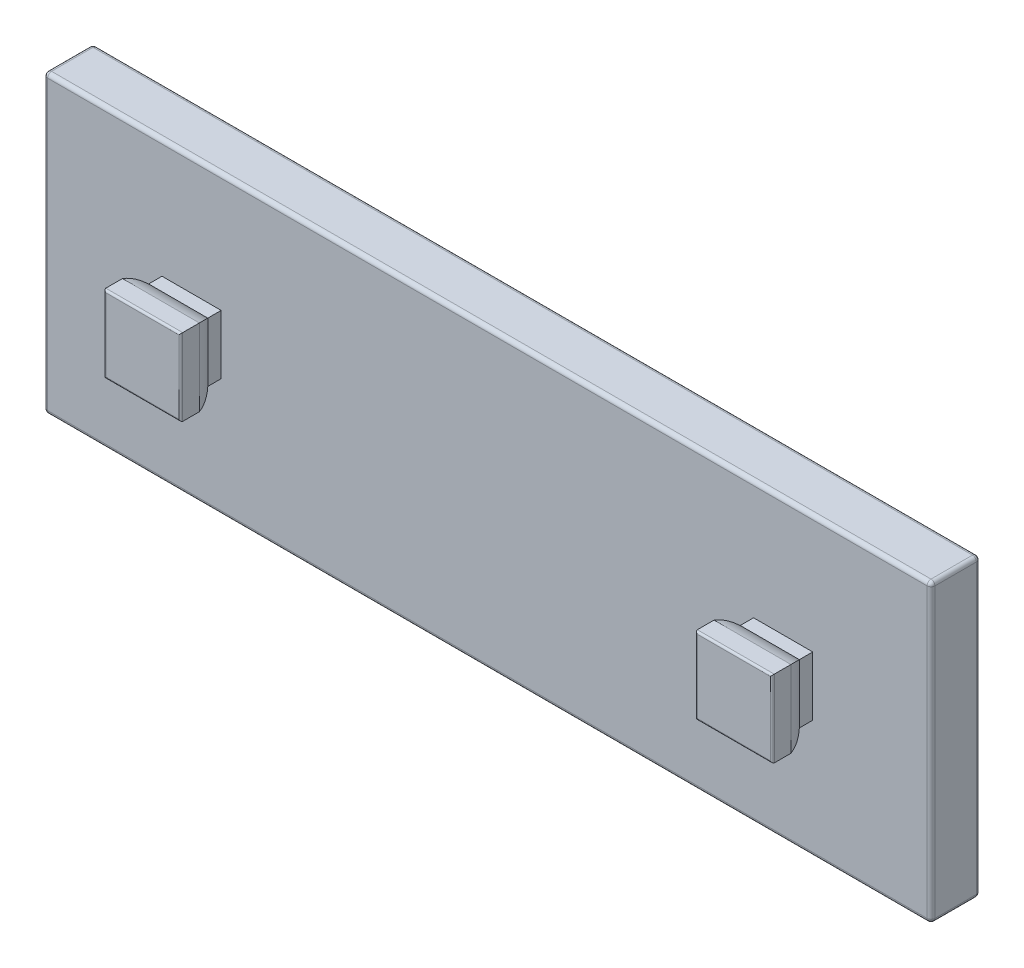
from build123d import *

# Parameters (mm, degrees)
SKETCH_1_W           = 45
SKETCH_1_H           = 15
EXTRUDE_1_DEPTH      = 2.5
SKETCH_2_W           = 3
SKETCH_2_H           = 3
EXTRUDE_2_DEPTH      = 1
EXTRUDE_3_DEPTH      = 2
EXTRUDE_3_DEPTH_BACK = 2
CUT_EXTRUDE_1_DEPTH  = 41.234344782
FILLET_1_R           = 0.2
FILLET_2_R           = 0.1
EXTRUDE_4_DEPTH      = 2
CUT_EXTRUDE_2_DEPTH  = 10
FILLET_3_R           = 0.1


with BuildPart() as part:
    # 草图1 → 凸台-拉伸1 (new body)
    with BuildSketch(Plane.XY):
        Rectangle(SKETCH_1_W, SKETCH_1_H)
    extrude(amount=-EXTRUDE_1_DEPTH)

    # 草图2 → 凸台-拉伸2 (add)
    with BuildSketch(Plane.XY):
        with Locations((-15, 0)):
            Rectangle(SKETCH_2_W, SKETCH_2_H)
        with Locations((15, 0)):
            Rectangle(SKETCH_2_W, SKETCH_2_H)
    extrude(amount=EXTRUDE_2_DEPTH)

    # 草图3 → 凸台-拉伸3 (add, two sides: drawn at the far end of the back side and taken through both)
    with BuildSketch(Plane(origin=(0, 0, 0), x_dir=(1, 0, 0), z_dir=(0, 1, 0)).offset(-EXTRUDE_3_DEPTH_BACK)):
        with BuildLine():
            Line((-16.95, -2.5), (-13.05, -2.5))
            Line((-13.05, -2.5), (-13.05, -1.555590279))
            ThreePointArc((-13.05, -1.555590279), (-13.219957697, -1.088161527), (-13.5, -0.677124344))
            Line((-13.5, -0.677124344), (-16.5, -0.677124344))
            ThreePointArc((-16.5, -0.677124344), (-16.780042303, -1.088161527), (-16.95, -1.555590279))
            Line((-16.95, -1.555590279), (-16.95, -2.5))
        make_face()
        with BuildLine():
            Line((16.5, -0.677124344), (13.5, -0.677124344))
            ThreePointArc((13.5, -0.677124344), (13.219957697, -1.088161527), (13.05, -1.555590279))
            Line((13.05, -1.555590279), (13.05, -2.5))
            Line((13.05, -2.5), (16.95, -2.5))
            Line((16.95, -2.5), (16.95, -1.555590279))
            ThreePointArc((16.95, -1.555590279), (16.780042303, -1.088161527), (16.5, -0.677124344))
        make_face()
    extrude(amount=EXTRUDE_3_DEPTH + EXTRUDE_3_DEPTH_BACK)

    # 草图4 → 切除-拉伸1 (cut, through all)
    with BuildSketch(Plane.ZY.offset(16.95)):
        with BuildLine():
            Line((2.5, 1.95), (1.555590279, 1.95))
            ThreePointArc((1.555590279, 1.95), (1.088161527, 1.780042303), (0.677124344, 1.5))
            Line((0.677124344, 1.5), (0.677124344, 2))
            Line((0.677124344, 2), (2.5, 2))
            Line((2.5, 2), (2.5, 1.95))
        make_face()
        with BuildLine():
            Line((0.677124344, -2), (2.5, -2))
            Line((2.5, -2), (2.5, -1.95))
            Line((2.5, -1.95), (1.555590279, -1.95))
            ThreePointArc((1.555590279, -1.95), (1.088161527, -1.780042303), (0.677124344, -1.5))
            Line((0.677124344, -1.5), (0.677124344, -2))
        make_face()
    extrude(amount=-CUT_EXTRUDE_1_DEPTH, mode=Mode.SUBTRACT)

    # 圆角1
    fillet_1_edges = [part.edges().sort_by_distance(p)[0] for p in [
        (22.5, 0, -2.5),
        (0, 7.5, -2.5),
        (-22.5, 0, -2.5),
        (0, 7.5, 0),
        (22.5, 0, 0),
        (0, -7.5, 0),
        (-22.5, 0, 0),
        (0, -7.5, -2.5),
        (-22.5, 7.5, -1.25),
        (22.5, 7.5, -1.25),
        (22.5, -7.5, -1.25),
        (-22.5, -7.5, -1.25),
    ]]
    fillet(fillet_1_edges, radius=FILLET_1_R)

    # 圆角2
    fillet_2_edges = [part.edges().sort_by_distance(p)[0] for p in [
        (13.05, 0, 2.5),
        (16.95, 0, 2.5),
        (-16.95, 0, 2.5),
        (-13.05, 0, 2.5),
        (-15, -1.95, 2.5),
        (15, -1.95, 2.5),
        (-15, 1.95, 2.5),
        (15, 1.95, 2.5),
    ]]
    fillet(fillet_2_edges, radius=FILLET_2_R)

    # 草图6 → 凸台-拉伸4 (add, symmetric)
    with BuildSketch(Plane(origin=(0, 0, 0), x_dir=(1, 0, 0), z_dir=(0, 1, 0))):
        with BuildLine():
            Line((-6, 2.5), (-9, 2.5))
            Line((-9, 2.5), (-9, 3.177124344))
            ThreePointArc((-9, 3.177124344), (-9.280042303, 3.588161527), (-9.45, 4.055590279))
            Line((-9.45, 4.055590279), (-9.45, 5))
            Line((-9.45, 5), (-5.55, 5))
            Line((-5.55, 5), (-5.55, 4.055590279))
            ThreePointArc((-5.55, 4.055590279), (-5.719957697, 3.588161527), (-6, 3.177124344))
            Line((-6, 3.177124344), (-6, 2.5))
        make_face()
    extrude_4 = extrude(amount=EXTRUDE_4_DEPTH, both=True)

    # 草图7 → 切除-拉伸2 (cut)
    with BuildSketch(Plane(origin=(0, 0, 0), x_dir=(0, 0, -1), z_dir=(1, 0, 0))):
        with BuildLine():
            Line((2.5, 1.5), (3.177124344, 1.5))
            ThreePointArc((3.177124344, 1.5), (3.588161527, 1.780042303), (4.055590279, 1.95))
            Line((4.055590279, 1.95), (5, 1.95))
            Line((5, 1.95), (5, 2))
            Line((5, 2), (2.5, 2))
            Line((2.5, 2), (2.5, 1.5))
        make_face()
        with BuildLine():
            Line((5, -1.95), (4.055590279, -1.95))
            ThreePointArc((4.055590279, -1.95), (3.588161527, -1.780042303), (3.177124344, -1.5))
            Line((3.177124344, -1.5), (2.5, -1.5))
            Line((2.5, -1.5), (2.5, -2))
            Line((2.5, -2), (5, -2))
            Line((5, -2), (5, -1.95))
        make_face()
    cut_extrude_2 = extrude(amount=-CUT_EXTRUDE_2_DEPTH, mode=Mode.SUBTRACT)

    # 镜向1: 凸台-拉伸4, 切除-拉伸2 across plane
    add(extrude_4.mirror(Plane(origin=(0, 0, 0), x_dir=(0, 0, 1), z_dir=(1, 0, 0))))
    add(cut_extrude_2.mirror(Plane(origin=(0, 0, 0), x_dir=(0, 0, 1), z_dir=(1, 0, 0))), mode=Mode.SUBTRACT)

    # 圆角3
    fillet_3_edges = [part.edges().sort_by_distance(p)[0] for p in [
        (-5.55, 0, -5),
        (-9.45, 0, -5),
        (-7.5, -1.95, -5),
        (-7.5, 1.95, -5),
        (9.45, 0, -5),
        (5.55, 0, -5),
        (7.5, -1.95, -5),
        (7.5, 1.95, -5),
    ]]
    fillet(fillet_3_edges, radius=FILLET_3_R)


solid = part.part
